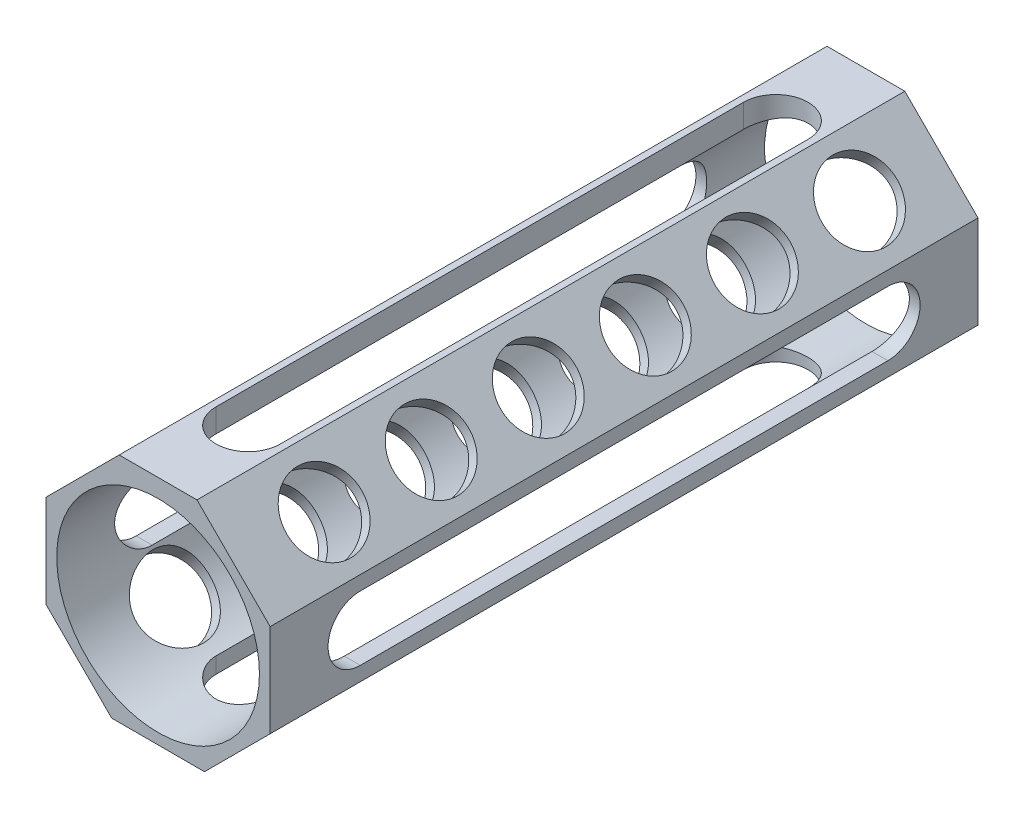
from build123d import *

# Parameters (mm, degrees)
SKIZZE1_R                        = 9.45
AUFSATZ_LINEAR_AUSTRAGEN1_DEPTH  = 66
SKIZZE9_R                        = 3.5
SCHNITT_LINEAR_AUSTRAGEN8_DEPTH  = 71.657475281
SCHNITT_LINEAR_AUSTRAGEN9_DEPTH  = 71.226758273
SCHNITT_LINEAR_AUSTRAGEN10_DEPTH = 71.122397393
SCHNITT_LINEAR_AUSTRAGEN11_DEPTH = 71.837658781


with BuildPart() as part:
    # Skizze1 → Aufsatz-Linear austragen1 (new body)
    with BuildSketch(Plane(origin=(0, 0, 0), x_dir=(0, 1, 0), z_dir=(0, 0, 1))):
        Polygon((11.150811659, 3.627720068), (11.150811659, -3.627720068), (4.328531727, -10.45), (-4.328531727, -10.45), (-10.45, -4.328531727), (-10.45, 4.328531727), (-4.328531727, 10.45), (4.328531727, 10.45), align=None)
        with Locations(Location((0, 0, 0), (0, 0, 270))):
            Circle(SKIZZE1_R, mode=Mode.SUBTRACT)
    extrude(amount=AUFSATZ_LINEAR_AUSTRAGEN1_DEPTH)

    # Skizze9 → Schnitt-Linear austragen8 (cut, through all)
    with BuildSketch(Plane(origin=(7.389265863, 7.389265863, 0), x_dir=(-0.7071067811865476, 0.7071067811865475, 0), z_dir=(0.7071067811865475, 0.7071067811865476, 0))):
        with Locations((0.432478845, 57.6)):
            Circle(SKIZZE9_R)
        with Locations((0.456584688, 47.600029055)):
            Circle(SKIZZE9_R)
        with Locations((0.480690531, 37.600058109)):
            Circle(SKIZZE9_R)
        with Locations((0.504796374, 27.600087164)):
            Circle(SKIZZE9_R)
        with Locations((0.528902217, 17.600116219)):
            Circle(SKIZZE9_R)
        with Locations((0.553008059, 7.600145273)):
            Circle(SKIZZE9_R)
    extrude(amount=-SCHNITT_LINEAR_AUSTRAGEN8_DEPTH, mode=Mode.SUBTRACT)

    # Skizze10 → Schnitt-Linear austragen9 (cut, through all)
    with BuildSketch(Plane(origin=(0, 11.150811659, 0), x_dir=(-1, 0, 0), z_dir=(0, 1, 0))):
        with BuildLine():
            Line((-3, 8.4), (-3, 57.6))
            ThreePointArc((-3, 57.6), (0, 60.6), (3, 57.6))
            Line((3, 57.6), (3, 8.4))
            ThreePointArc((3, 8.4), (0, 5.4), (-3, 8.4))
        make_face()
    extrude(amount=-SCHNITT_LINEAR_AUSTRAGEN9_DEPTH, mode=Mode.SUBTRACT)

    # Skizze11 → Schnitt-Linear austragen10 (cut, through all)
    with BuildSketch(Plane.YZ.offset(10.45)):
        with BuildLine():
            Line((-3, 8.4), (-3, 57.6))
            ThreePointArc((-3, 57.6), (0, 60.6), (3, 57.6))
            Line((3, 57.6), (3, 8.4))
            ThreePointArc((3, 8.4), (0, 5.4), (-3, 8.4))
        make_face()
    extrude(amount=-SCHNITT_LINEAR_AUSTRAGEN10_DEPTH, mode=Mode.SUBTRACT)

    # Skizze12 → Schnitt-Linear austragen11 (cut, through all)
    with BuildSketch(Plane(origin=(7.389265863, -7.389265863, 0), x_dir=(0.7071067811865471, 0.7071067811865479, 0), z_dir=(0.7071067811865479, -0.7071067811865471, 0))):
        with BuildLine():
            Line((-3, 8.4), (-3, 57.6))
            ThreePointArc((-3, 57.6), (0, 60.6), (3, 57.6))
            Line((3, 57.6), (3, 8.4))
            ThreePointArc((3, 8.4), (0, 5.4), (-3, 8.4))
        make_face()
    extrude(amount=-SCHNITT_LINEAR_AUSTRAGEN11_DEPTH, mode=Mode.SUBTRACT)


solid = part.part
